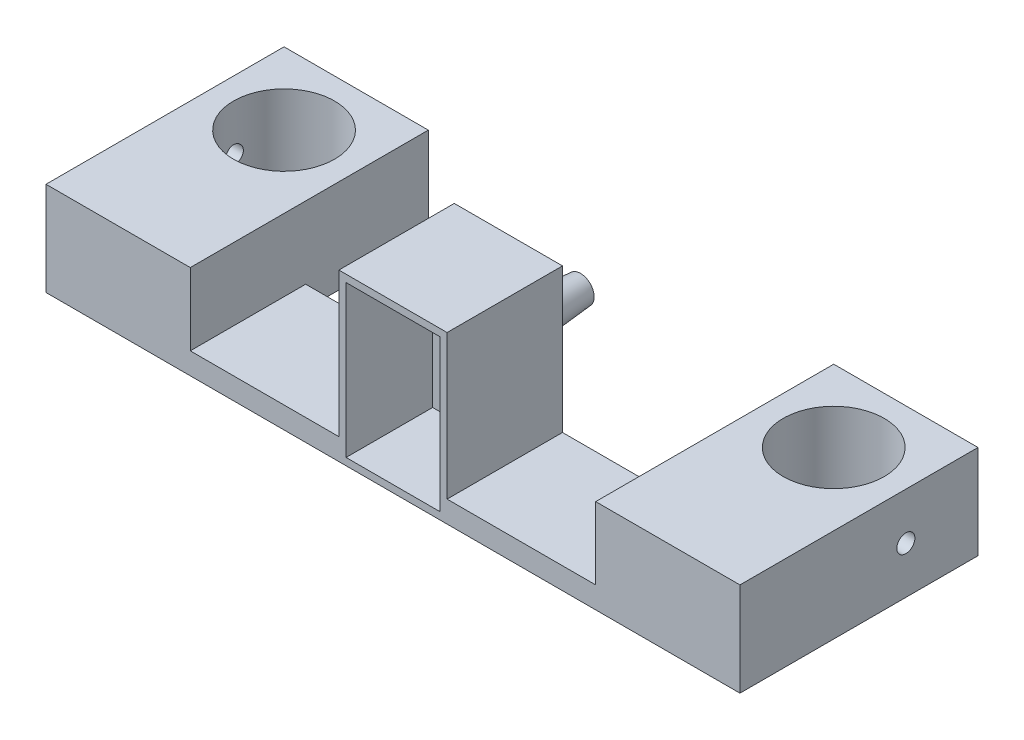
from build123d import *

# Parameters (mm, degrees)
SKETCH1_R               = 7
BOSS_EXTRUDE1_DEPTH     = 13
SKETCH2_W               = 56.2
SKETCH2_H               = 16
CUT_EXTRUDE1_DEPTH      = 10
CUT_EXTRUDE2_REACH      = 56.246
SKETCH3_W               = 15
SKETCH3_H               = 16
SKETCH4_W               = 15
SKETCH4_H               = 23
BOSS_EXTRUDE2_DEPTH     = 16
SKETCH5_W               = 13
SKETCH5_H               = 21
CUT_EXTRUDE3_DEPTH      = 12
CUT_EXTRUDE4_REACH      = 59.303
SKETCH6_R               = 1.5
SKETCH6_R_2             = 1.05
SKETCH7_R               = 2.5
SKETCH7_R_2             = 1.5
BOSS_EXTRUDE3_DEPTH     = 10
CHAMFER1_SIZE           = 7
CHAMFER1_SIZE2          = 0.612420645
CUT_EXTRUDE5_REACH      = 103.55
CUT_EXTRUDE5_END_RADIUS = 7
SKETCH8_R               = 1.25
CUT_EXTRUDE6_REACH      = 103.55
CUT_EXTRUDE6_END_RADIUS = 7
SKETCH9_R               = 1.25


with BuildPart() as part:
    # Sketch1 → Boss-Extrude1 (new body)
    with BuildSketch(Plane(origin=(0, 0, 0), x_dir=(1, 0, 0), z_dir=(0, 1, 0))):
        Polygon((-28.1, -7), (-28.1, 10), (-48.1, 10), (-48.1, -23), (-28.1, -23), (28.1, -23), (48.1, -23), (48.1, 10), (28.1, 10), (28.1, -7), align=None)
        with Locations(Location((-38.1, 0, 0), (0, 0, 90))):
            Circle(SKETCH1_R, mode=Mode.SUBTRACT)
        with Locations(Location((38.1, 0, 0), (0, 0, 90))):
            Circle(SKETCH1_R, mode=Mode.SUBTRACT)
    extrude(amount=BOSS_EXTRUDE1_DEPTH)

    # Sketch2 → Cut-Extrude1 (cut)
    with BuildSketch(Plane(origin=(0, 13, 0), x_dir=(1, 0, 0), z_dir=(0, 1, 0))):
        with Locations((0, -15)):
            Rectangle(SKETCH2_W, SKETCH2_H)
    extrude(amount=-CUT_EXTRUDE1_DEPTH, mode=Mode.SUBTRACT)

    # Sketch3 → Cut-Extrude2 (cut, up to next)
    with BuildSketch(Plane(origin=(0, 3, 0), x_dir=(1, 0, 0), z_dir=(0, 1, 0)), mode=Mode.PRIVATE) as cut_extrude2_sk1:
        with Locations((0, -15)):
            Rectangle(SKETCH3_W, SKETCH3_H)
    cut_extrude2_tool1 = extrude(cut_extrude2_sk1.sketch, amount=-CUT_EXTRUDE2_REACH, mode=Mode.PRIVATE) & part.part
    add(cut_extrude2_tool1.solids().sort_by_distance((0, 3, 15))[0], mode=Mode.SUBTRACT)


with BuildPart() as cut_extrude2_piece_1:
    # of the separate pieces the step leaves, piece 1, a body of its own (cut_extrude2_pieces)
    add(part.part.solids().sort_by_distance((28.1, 0, 7))[0])



with BuildPart() as cut_extrude2_piece_2:
    # of the separate pieces the step leaves, piece 2, a body of its own (cut_extrude2_pieces)
    add(part.part.solids().sort_by_distance((-28.1, 0, 7))[0])


with BuildPart() as cut_extrude2_piece_1_1:
    add(cut_extrude2_piece_1.part)

    add(cut_extrude2_piece_2.part)  # Boss-Extrude2 merges Cut-Extrude2 piece 2
    # Sketch4 → Boss-Extrude2 (add)
    with BuildSketch(Plane.XY.offset(23)):
        with Locations((0, 11.5)):
            Rectangle(SKETCH4_W, SKETCH4_H)
    extrude(amount=-BOSS_EXTRUDE2_DEPTH)

    # Sketch5 → Cut-Extrude3 (cut)
    with BuildSketch(Plane.XY.offset(23)):
        with Locations((0, 11.5)):
            Rectangle(SKETCH5_W, SKETCH5_H)
    extrude(amount=-CUT_EXTRUDE3_DEPTH, mode=Mode.SUBTRACT)

    # Sketch6 → Cut-Extrude4 (cut, up to next)
    with BuildSketch(Plane.XY.offset(11), mode=Mode.PRIVATE) as cut_extrude4_sk1:
        with Locations((0, 11.464154045)):
            Circle(SKETCH6_R)
    cut_extrude4_tool1 = extrude(cut_extrude4_sk1.sketch, amount=-CUT_EXTRUDE4_REACH, mode=Mode.PRIVATE) & cut_extrude2_piece_1_1.part
    # Sketch6 → Cut-Extrude4 (cut, up to next)
    with BuildSketch(Plane.XY.offset(11), mode=Mode.PRIVATE) as cut_extrude4_sk2:
        with Locations((0, 6.964154045)):
            Circle(SKETCH6_R_2)
    cut_extrude4_tool2 = extrude(cut_extrude4_sk2.sketch, amount=-CUT_EXTRUDE4_REACH, mode=Mode.PRIVATE) & cut_extrude2_piece_1_1.part
    add(cut_extrude4_tool1.solids().sort_by_distance((0, 11.464154, 11))[0], mode=Mode.SUBTRACT)
    add(cut_extrude4_tool2.solids().sort_by_distance((0, 6.964154, 11))[0], mode=Mode.SUBTRACT)

    # Sketch7 → Boss-Extrude3 (add)
    with BuildSketch(Plane(origin=(0, 0, 7), x_dir=(-1, 0, 0), z_dir=(0, 0, -1))):
        with Locations(Location((0, 11.464154045, 0), (0, 0, 180))):
            Circle(SKETCH7_R)
        with Locations(Location((0, 11.464154045, 0), (0, 0, 180))):
            Circle(SKETCH7_R_2, mode=Mode.SUBTRACT)
    extrude(amount=BOSS_EXTRUDE3_DEPTH)

    # Chamfer1
    chamfer1_edges = [cut_extrude2_piece_1_1.edges().sort_by_distance(p)[0] for p in [
        (-2.5, 11.464154045, -3),
    ]]
    chamfer1_side = [cut_extrude2_piece_1_1.faces().sort_by_distance(p)[0] for p in [
        (-2.5, 11.464154045, 2),
    ]]
    chamfer(chamfer1_edges, length=CHAMFER1_SIZE, length2=CHAMFER1_SIZE2, reference=chamfer1_side[0])

    # Cut-Extrude5: up to this cylinder (the profile starts outside it)
    cut_extrude5_end = Plane(origin=(-38.1, 6.5, 0), z_dir=(0, -1, 0)) * Cylinder(CUT_EXTRUDE5_END_RADIUS, 222.1, mode=Mode.PRIVATE)
    # Sketch8 → Cut-Extrude5 (cut, up to the surface)
    with BuildSketch(Plane.ZY.offset(48.1), mode=Mode.PRIVATE) as cut_extrude5_sk1:
        with Locations((0, 6.5)):
            Circle(SKETCH8_R)
    cut_extrude5_tool1 = extrude(cut_extrude5_sk1.sketch, amount=-CUT_EXTRUDE5_REACH, mode=Mode.PRIVATE) - cut_extrude5_end
    add(cut_extrude5_tool1.solids().sort_by_distance((-48.1, 6.5, 0))[0], mode=Mode.SUBTRACT)

    # Cut-Extrude6: up to this cylinder (the profile starts outside it)
    cut_extrude6_end = Plane(origin=(38.1, 6.5, 0), z_dir=(0, -1, 0)) * Cylinder(CUT_EXTRUDE6_END_RADIUS, 222.1, mode=Mode.PRIVATE)
    # Sketch9 → Cut-Extrude6 (cut, up to the surface)
    with BuildSketch(Plane(origin=(48.1, 0, 0), x_dir=(0, 0, -1), z_dir=(1, 0, 0)), mode=Mode.PRIVATE) as cut_extrude6_sk1:
        with Locations(Location((0, 6.5, 0), (0, 0, 180))):
            Circle(SKETCH9_R)
    cut_extrude6_tool1 = extrude(cut_extrude6_sk1.sketch, amount=-CUT_EXTRUDE6_REACH, mode=Mode.PRIVATE) - cut_extrude6_end
    add(cut_extrude6_tool1.solids().sort_by_distance((48.1, 6.5, 0))[0], mode=Mode.SUBTRACT)


solid = cut_extrude2_piece_1_1.part
